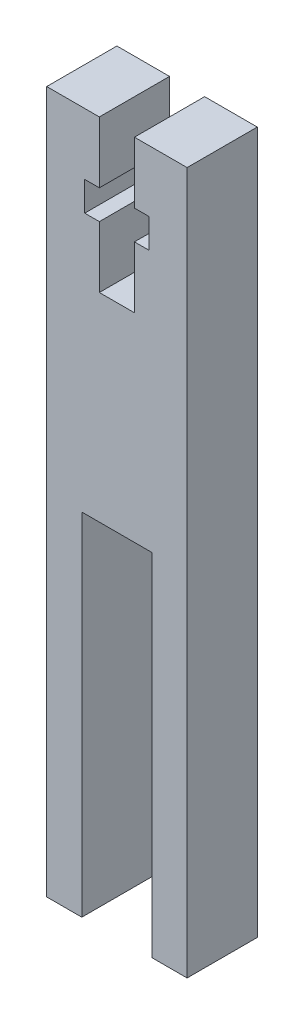
from build123d import *

# Parameters (mm, degrees)
EXTRUDE_1_DEPTH = 6


with BuildPart() as part:
    # Эскиз1 → Бобышка-Вытянуть1 (new body)
    with BuildSketch(Plane.XY):
        Polygon((-1.5, 60), (-1.5, 54.75), (-2.75, 54.75), (-2.75, 52.25), (-1.5, 52.25), (-1.5, 47), (1.5, 47), (1.5, 52.25), (2.75, 52.25), (2.75, 54.75), (1.5, 54.75), (1.5, 60), (6, 60), (6, 0), (3, 0), (3, 30), (-3, 30), (-3, 0), (-6, 0), (-6, 60), align=None)
    extrude(amount=EXTRUDE_1_DEPTH)


solid = part.part
